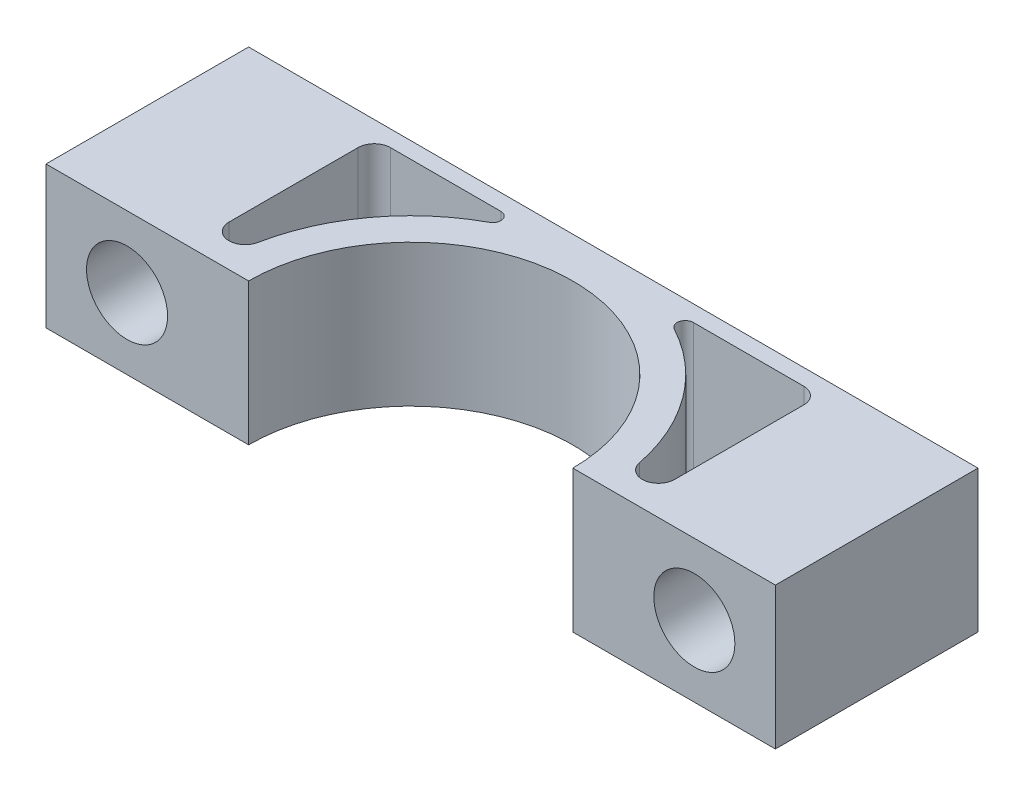
from build123d import *

# Parameters (mm, degrees)
BOSS_EXTRUDE1_DEPTH = 5.5626
SKETCH2_R           = 3.175
CUT_EXTRUDE1_DEPTH  = 34.158539907


with BuildPart() as part:
    # Sketch1 → Boss-Extrude1 (new, symmetric)
    with BuildSketch(Plane(origin=(0, 0, 0), x_dir=(1, 0, 0), z_dir=(0, 1, 0))):
        with BuildLine():
            Line((-12.7, 0), (-28.575, 0))
            Line((-28.575, 0), (-28.575, 15.875))
            Line((-28.575, 15.875), (28.575, 15.875))
            Line((28.575, 15.875), (28.575, 0))
            Line((28.575, 0), (12.7, 0))
            ThreePointArc((12.7, 0), (0, 12.7), (-12.7, 0))
        make_face()
        with BuildLine():
            Line((16.1925, 14.605), (7.540207225, 14.605))
            ThreePointArc((7.540207225, 14.605), (6.924551883, 14.125542599), (7.238598936, 13.4112))
            ThreePointArc((7.238598936, 13.4112), (12.258915713, 9.054092199), (14.946923077, 2.974405913))
            ThreePointArc((14.946923077, 2.974405913), (16.317033746, 1.958393589), (17.4625, 3.222273072))
            Line((17.4625, 3.222273072), (17.4625, 13.335))
            ThreePointArc((17.4625, 13.335), (17.090525612, 14.233025612), (16.1925, 14.605))
        make_face(mode=Mode.SUBTRACT)
        with BuildLine():
            Line((-17.4625, 3.222273072), (-17.4625, 13.335))
            ThreePointArc((-17.4625, 13.335), (-17.090525612, 14.233025612), (-16.1925, 14.605))
            Line((-16.1925, 14.605), (-7.540207225, 14.605))
            ThreePointArc((-7.540207225, 14.605), (-6.924551883, 14.125542599), (-7.238598936, 13.4112))
            ThreePointArc((-7.238598936, 13.4112), (-12.258915713, 9.054092199), (-14.946923077, 2.974405913))
            ThreePointArc((-14.946923077, 2.974405913), (-16.317033746, 1.958393589), (-17.4625, 3.222273072))
        make_face(mode=Mode.SUBTRACT)
    extrude(amount=BOSS_EXTRUDE1_DEPTH, both=True)

    # Sketch2 → Cut-Extrude1 (cut, through all)
    with BuildSketch(Plane.XY):
        with Locations((-22.225, 0)):
            Circle(SKETCH2_R)
        with Locations((22.225, 0)):
            Circle(SKETCH2_R)
    extrude(amount=-CUT_EXTRUDE1_DEPTH, mode=Mode.SUBTRACT)


solid = part.part
